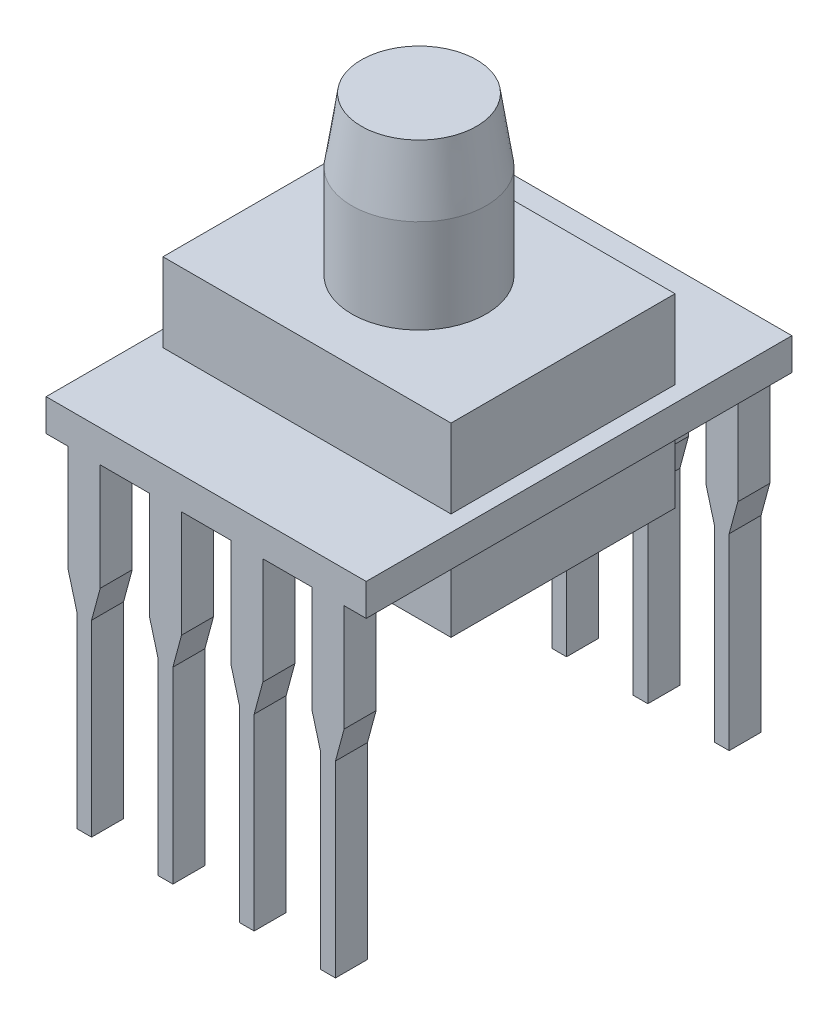
from build123d import *

# Parameters (mm, degrees)
SKETCH1_W                = 10
SKETCH1_H                = 13.3
BOSS_EXTRUDE1_DEPTH      = 1
BOSS_EXTRUDE2_DEPTH      = 2.46
BOSS_EXTRUDE2_DEPTH_BACK = 3.34
SKETCH2_W                = 9
SKETCH2_H                = 7
SKETCH3_R                = 2.1
BOSS_EXTRUDE3_DEPTH      = 4.93
CHAMFER1_SIZE            = 2
CHAMFER1_SIZE2           = 0.3
BOSS_EXTRUDE4_DEPTH      = 1


with BuildPart() as part:
    # Sketch1 → Boss-Extrude1 (new body)
    with BuildSketch(Plane(origin=(0, 0, 0), x_dir=(1, 0, 0), z_dir=(0, 1, 0))):
        Rectangle(SKETCH1_W, SKETCH1_H)
    extrude(amount=BOSS_EXTRUDE1_DEPTH)

    # Sketch2 → Boss-Extrude2 (add, two sides: drawn at the far end of the back side and taken through both)
    with BuildSketch(Plane(origin=(0, 1, 0), x_dir=(1, 0, 0), z_dir=(0, 1, 0)).offset(-BOSS_EXTRUDE2_DEPTH_BACK)):
        Rectangle(SKETCH2_W, SKETCH2_H)
    extrude(amount=BOSS_EXTRUDE2_DEPTH + BOSS_EXTRUDE2_DEPTH_BACK)

    # Sketch3 → Boss-Extrude3 (add)
    with BuildSketch(Plane(origin=(0, 3.46, 0), x_dir=(1, 0, 0), z_dir=(0, 1, 0))):
        with Locations(Location((0, 0, 0), (0, 0, 270))):
            Circle(SKETCH3_R)
    extrude(amount=BOSS_EXTRUDE3_DEPTH)

    # Chamfer1
    chamfer1_edges = [part.edges().sort_by_distance(p)[0] for p in [
        (0, 8.39, -2.1),
    ]]
    chamfer1_side = [part.faces().sort_by_distance(p)[0] for p in [
        (0, 5.925, -2.1),
    ]]
    chamfer(chamfer1_edges, length=CHAMFER1_SIZE, length2=CHAMFER1_SIZE2, reference=chamfer1_side[0])

    # Sketch5 → Boss-Extrude4 (add)
    with BuildSketch(Plane.XY.offset(6.65)):
        Polygon((-4.31, 1), (-4.31, -3.34), (-4.04, -4.34), (-4.04, -10.21), (-3.58, -10.21), (-3.58, -4.34), (-3.31, -3.34), (-3.31, 1), align=None)
        Polygon((-1.77, 1), (-1.77, -3.34), (-1.5, -4.34), (-1.5, -10.21), (-1.04, -10.21), (-1.04, -4.34), (-0.77, -3.34), (-0.77, 1), align=None)
        Polygon((0.77, 1), (0.77, -3.34), (1.04, -4.34), (1.04, -10.21), (1.5, -10.21), (1.5, -4.34), (1.77, -3.34), (1.77, 1), align=None)
        Polygon((3.31, 1), (3.31, -3.34), (3.58, -4.34), (3.58, -10.21), (4.04, -10.21), (4.04, -4.34), (4.31, -3.34), (4.31, 1), align=None)
    boss_extrude4 = extrude(amount=-BOSS_EXTRUDE4_DEPTH)

    # Mirror1: Boss-Extrude4 across plane
    add(boss_extrude4.mirror(Plane.XY))


solid = part.part
